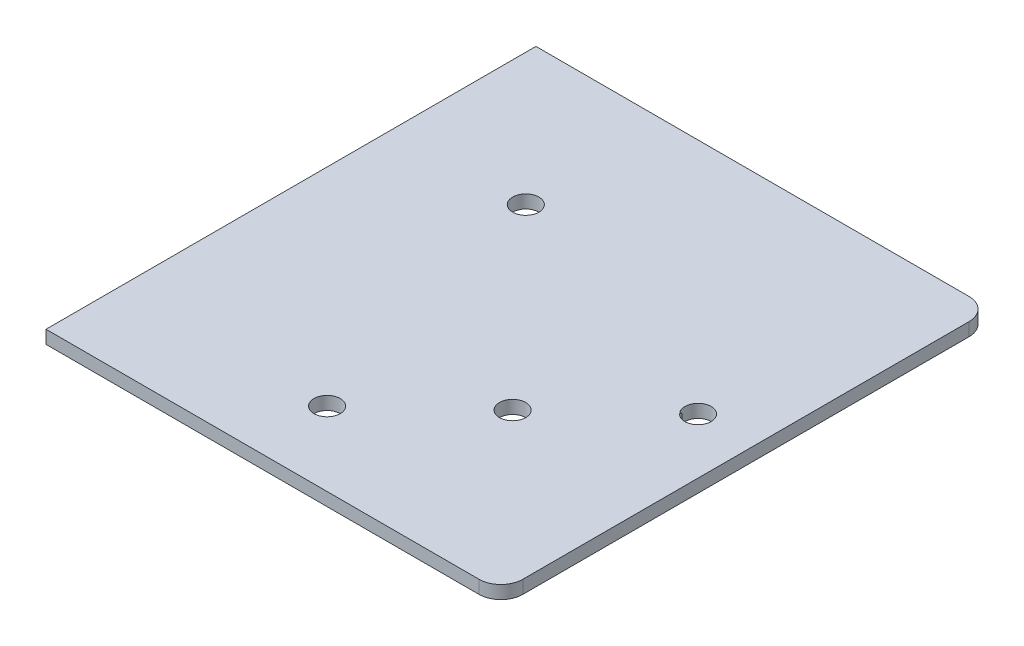
from build123d import *

# Parameters (mm, degrees)
BOSS_EXTRUDE1_DEPTH = 9.525
BOSS_EXTRUDE2_DEPTH = 9.525
FILLET1_R           = 15.875
SKETCH3_R           = 9.525
CUT_EXTRUDE1_DEPTH  = 587.481888574


with BuildPart() as part:
    # Sketch1 → Boss-Extrude1 (new body)
    with BuildSketch(Plane(origin=(0, 0, 0), x_dir=(1, 0, 0), z_dir=(0, 1, 0))):
        Polygon((461.512355724, 17.636671785), (558.8, 99.270698215), (558.8, 177.8), (228.6, 177.8), (228.6, -177.8), align=None)
    extrude(amount=BOSS_EXTRUDE1_DEPTH)

    # Sketch1<4> → Boss-Extrude2 (add)
    with BuildSketch(Plane(origin=(0, 0, 0), x_dir=(1, 0, 0), z_dir=(0, 1, 0))):
        Polygon((558.8, -177.8), (558.8, 99.270698215), (461.512355724, 17.636671785), (228.6, -177.8), align=None)
    extrude(amount=BOSS_EXTRUDE2_DEPTH)

    # Fillet1
    fillet1_edges = [part.edges().sort_by_distance(p)[0] for p in [
        (558.8, 4.7625, 177.8),
        (558.8, 4.7625, -177.8),
    ]]
    fillet(fillet1_edges, radius=FILLET1_R)

    # Sketch3 → Cut-Extrude1 (cut, through all)
    with BuildSketch(Plane.XZ):
        with Locations((378.930433901, 124.074982269)):
            Circle(SKETCH3_R)
        with Locations((448.729013979, 59.262015054)):
            Circle(SKETCH3_R)
        with BuildLine():
            Line((511.547736048, 0.930344561), (512.549645575, 0))
            Line((512.549645575, 0), (510.787273965, 0))
            ThreePointArc((510.787273965, 0), (525.902368362, -11.579080306), (511.547736048, 0.930344561))
        make_face()
        with Locations((324.376240195, -74.656356713)):
            Circle(SKETCH3_R)
    extrude(amount=-CUT_EXTRUDE1_DEPTH, mode=Mode.SUBTRACT)


solid = part.part
